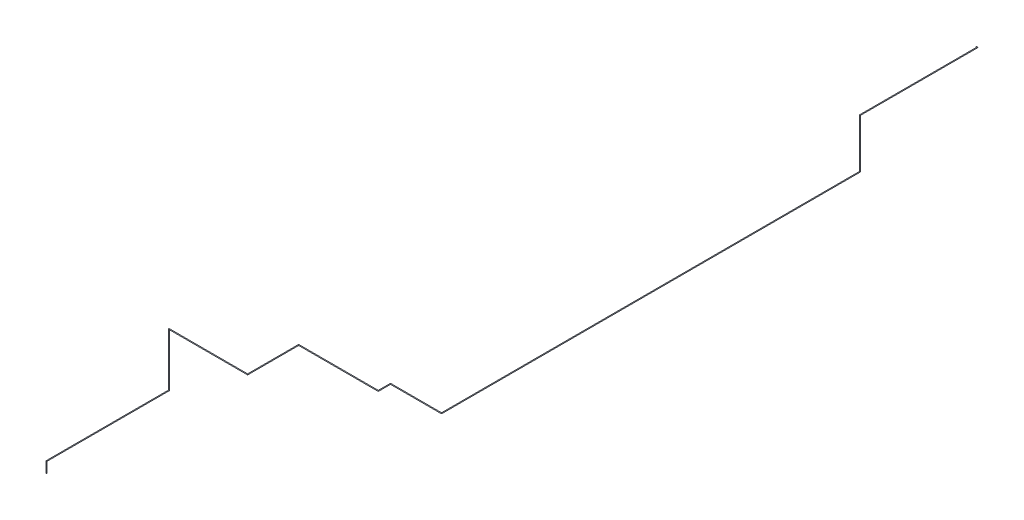
from build123d import *

# Parameters (mm, degrees)
CROQUIS2_R              = 12.7
SALIENTE_EXTRUIR1_DEPTH = 20
CROQUIS3_R              = 17.5
CROQUIS4_W              = 0.511597732
CROQUIS4_H              = 0.43534191
SALIENTE_EXTRUIR2_DEPTH = 5


with BuildPart() as part:
    # Croquis2 → Saliente-Extruir1 (new body)
    with BuildSketch(Plane(origin=(0, 0, 0), x_dir=(1, 0, 0), z_dir=(0, 1, 0))):
        with Locations(Location((0, 0, 0), (0, 0, 270))):
            Circle(CROQUIS2_R)
    extrude(amount=SALIENTE_EXTRUIR1_DEPTH)

    # Barrer1: sweep along a curve in space
    with BuildLine() as barrer1_path:
        Line((0, 20, 0), (0, 520, 0))
        Line((0, 520, 0), (0, 520, -6005))
        Line((0, 520, -6005), (0, 3120, -6005))
        Line((0, 3120, -6005), (3850, 3120, -6005))
        Line((3850, 3120, -6005), (3850, 3120, -8505))
        Line((3850, 3120, -8505), (7750, 3120, -8505))
        Line((7750, 3120, -8505), (7750, 3120, -9105))
        Line((7750, 3120, -9105), (10250, 3120, -9105))
        Line((10250, 3120, -9105), (10250, 3120, -29605))
        Line((10250, 3120, -29605), (10250, 5520, -29605))
        Line((10250, 5520, -29605), (10250, 5520, -35355))
        Line((10250, 5520, -35355), (10210, 5520, -35355))
    # Croquis3 → Barrer1 (sweep)
    with BuildSketch(Plane(origin=(0, 20, 0), x_dir=(1, 0, 0), z_dir=(0, 1, 0))):
        Circle(CROQUIS3_R)
    sweep(path=barrer1_path.line, transition=Transition.RIGHT)

    # Croquis4 → Saliente-Extruir2 (add)
    with BuildSketch(Plane.XZ):
        with Locations((0, 12.7)):
            Rectangle(CROQUIS4_W, CROQUIS4_H)
    extrude(amount=-SALIENTE_EXTRUIR2_DEPTH)


solid = part.part
